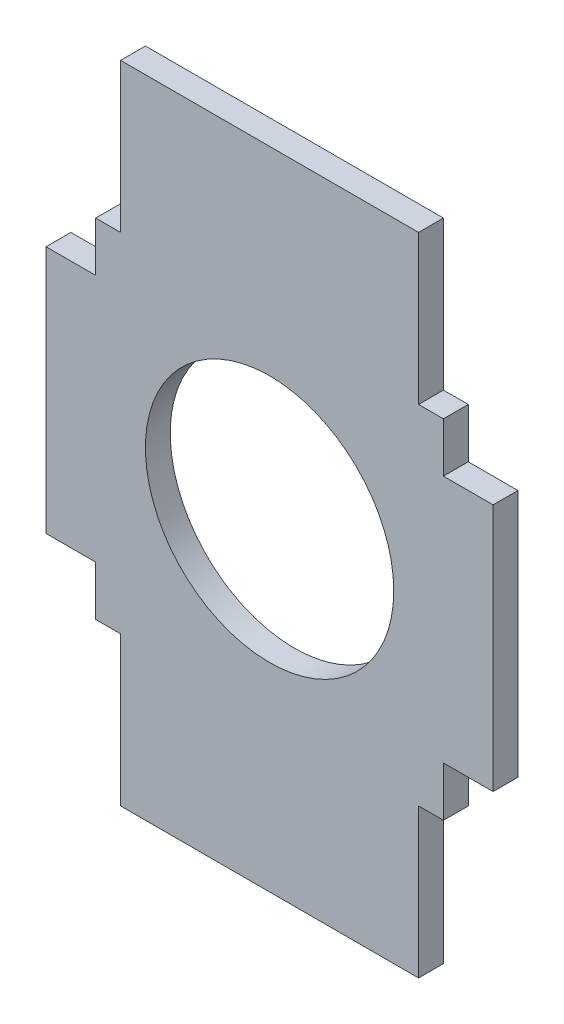
from build123d import *

# Parameters (mm, degrees)
SKETCH1_R           = 15.875
BOSS_EXTRUDE1_DEPTH = 3.175


with BuildPart() as part:
    # Sketch1 → Boss-Extrude1 (new body)
    with BuildSketch(Plane.XY):
        Polygon((-0.558515458, 289.07227709), (37.541484542, 289.07227709), (37.541484542, 308.12227709), (40.716484541, 308.12227709), (40.716484541, 314.47227709), (47.06648454, 314.47227709), (47.06648454, 346.22227709), (40.716484541, 346.22227709), (40.716484541, 352.57227709), (37.541484542, 352.57227709), (37.541484542, 371.62227709), (-0.558515458, 371.62227709), (-0.558515458, 352.57227709), (-3.733515459, 352.57227709), (-3.733515459, 346.22227709), (-10.083515458, 346.22227709), (-10.083515458, 314.47227709), (-3.733515459, 314.47227709), (-3.733515459, 308.12227709), (-0.558515458, 308.12227709), align=None)
        with Locations((18.491484542, 330.34727709)):
            Circle(SKETCH1_R, mode=Mode.SUBTRACT)
    extrude(amount=-BOSS_EXTRUDE1_DEPTH)


solid = part.part
